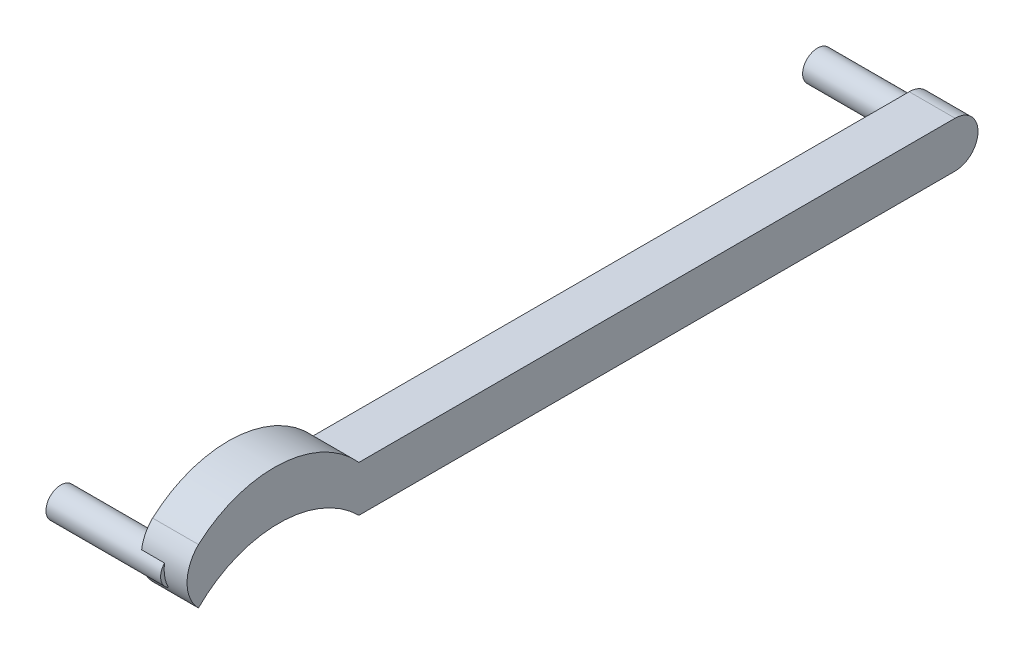
from build123d import *

# Parameters (mm, degrees)
BOSS_EXTRUDE1_DEPTH = 1
SKETCH2_R           = 0.65
BOSS_EXTRUDE2_DEPTH = 5
SKETCH3_R           = 0.65
BOSS_EXTRUDE3_DEPTH = 5


with BuildPart() as part:
    # Sketch1 → Boss-Extrude1 (new, symmetric)
    with BuildSketch(Plane(origin=(0, 0, 0), x_dir=(0, 0, -1), z_dir=(1, 0, 0))):
        with BuildLine():
            Line((16.5, 1), (-9.5, 1))
            ThreePointArc((-9.5, 1), (-12.917652634, 2.648551595), (-16.5, 1.397608254))
            ThreePointArc((-16.5, 1.397608254), (-16.996560928, 0.198804127), (-16.5, -1))
            ThreePointArc((-16.5, -1), (-13, 0.449747468), (-9.5, -1))
            Line((-9.5, -1), (16.5, -1))
            ThreePointArc((16.5, -1), (17.5, 0), (16.5, 1))
        make_face()
    extrude(amount=BOSS_EXTRUDE1_DEPTH, both=True)

    # Sketch2 → Boss-Extrude2 (add)
    with BuildSketch(Plane(origin=(0, 0, 0), x_dir=(0, 0, -1), z_dir=(1, 0, 0))):
        with Locations((-16.5, 0)):
            Circle(SKETCH2_R)
    extrude(amount=-BOSS_EXTRUDE2_DEPTH)

    # Sketch3 → Boss-Extrude3 (add)
    with BuildSketch(Plane(origin=(0, 0, 0), x_dir=(0, 0, -1), z_dir=(1, 0, 0))):
        with Locations((16.5, 0)):
            Circle(SKETCH3_R)
    extrude(amount=-BOSS_EXTRUDE3_DEPTH)


solid = part.part
